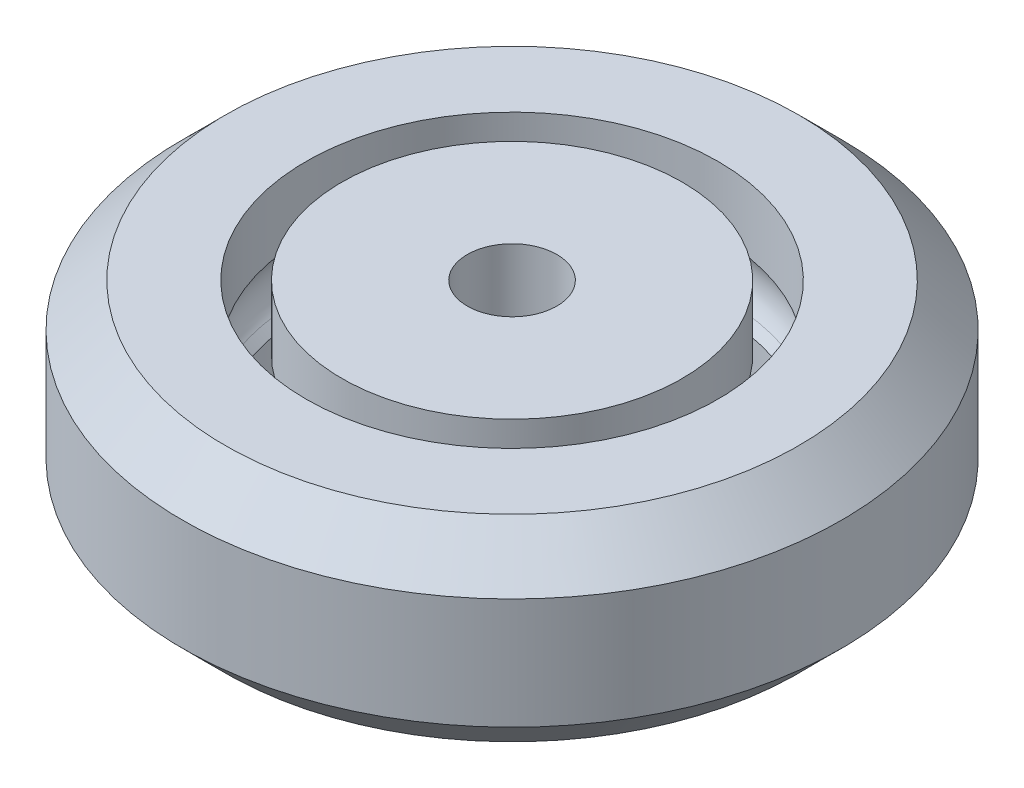
from build123d import *

# Parameters (mm, degrees)
SKETCH2_W = 2.5
SKETCH2_H = 11


with BuildPart() as part:
    # Sketch2 → Revolve2 (revolve)
    with BuildSketch(Plane.XY, mode=Mode.PRIVATE) as revolve2_sk:
        with Locations((3.75, 0)):
            Rectangle(SKETCH2_W, SKETCH2_H)
        with BuildLine():
            Line((9.068108768, -1.431891232), (9.5, -1.863782464))
            Line((9.5, -1.863782464), (9.5, -5.5))
            Line((9.5, -5.5), (5, -5.5))
            Line((5, -5.5), (5, 5.5))
            Line((5, 5.5), (9.5, 5.5))
            Line((9.5, 5.5), (9.5, 1.863782464))
            Line((9.5, 1.863782464), (9.068108768, 1.431891232))
            ThreePointArc((9.068108768, 1.431891232), (8.475, 0), (9.068108768, -1.431891232))
        make_face()
        with BuildLine():
            ThreePointArc((11.931891232, -1.431891232), (12.525, 0), (11.931891232, 1.431891232))
            Line((11.931891232, 1.431891232), (11.5, 1.863782464))
            Line((11.5, 1.863782464), (11.5, 5.5))
            Line((11.5, 5.5), (16, 5.5))
            Line((16, 5.5), (16, -5.5))
            Line((16, -5.5), (11.5, -5.5))
            Line((11.5, -5.5), (11.5, -1.863782464))
            Line((11.5, -1.863782464), (11.931891232, -1.431891232))
        make_face()
        Polygon((18.4, -3.1), (16, -5.5), (16, 5.5), (18.4, 3.1), align=None)
    revolve(revolve2_sk.sketch.rotate(Axis((0, 0, 0), (0, 1, 0)), 90), axis=Axis((0, 0, 0), (0, 1, 0)))


solid = part.part
